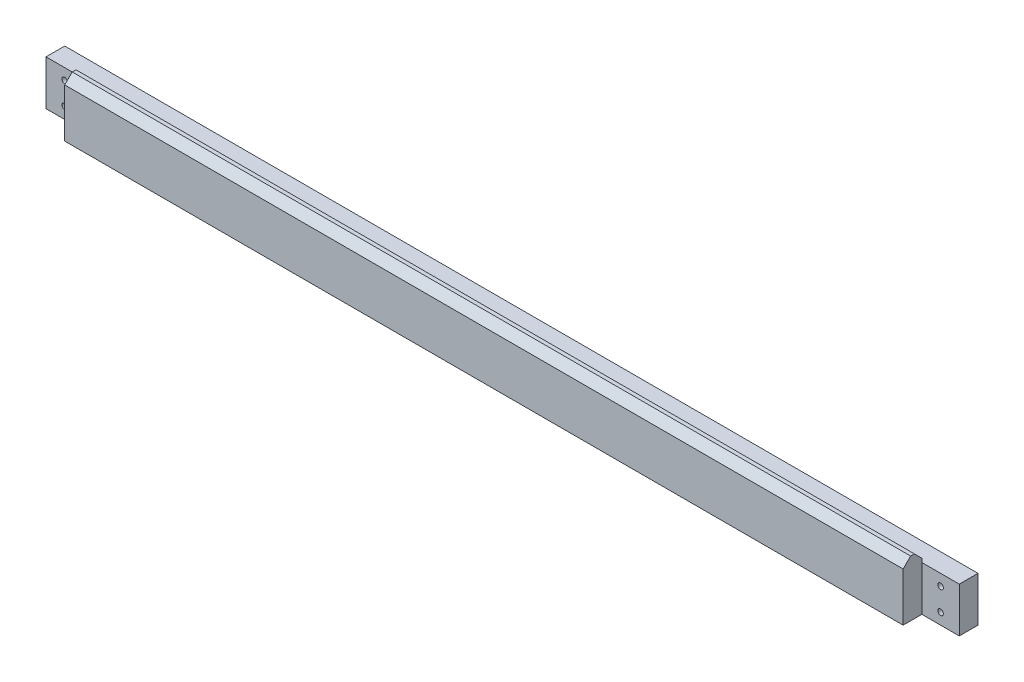
from build123d import *

# Parameters (mm, degrees)
SKETCH1_W           = 1549.4
SKETCH1_H           = 76.2
BOSS_EXTRUDE1_DEPTH = 31.75
SKETCH2_R           = 4.7625
CUT_EXTRUDE1_DEPTH  = 777.285876788
SKETCH3_W           = 1422.4
SKETCH3_H           = 95.25
BOSS_EXTRUDE2_DEPTH = 31.75
CHAMFER1_SIZE       = 12.7


with BuildPart() as part:
    # Sketch1 → Boss-Extrude1 (new body)
    with BuildSketch(Plane.XY):
        Rectangle(SKETCH1_W, SKETCH1_H)
    extrude(amount=BOSS_EXTRUDE1_DEPTH)

    # Sketch2 → Cut-Extrude1 (cut, through all)
    with BuildSketch(Plane.XY.offset(31.75)):
        with Locations((742.95, 19.05)):
            Circle(SKETCH2_R)
        with Locations((742.95, -19.05)):
            Circle(SKETCH2_R)
    cut_extrude1 = extrude(amount=-CUT_EXTRUDE1_DEPTH, mode=Mode.SUBTRACT)

    # Mirror1: Cut-Extrude1 across plane
    add(cut_extrude1.mirror(Plane(origin=(0, 0, 0), x_dir=(0, 0, 1), z_dir=(1, 0, 0))), mode=Mode.SUBTRACT)

    # Sketch3 → Boss-Extrude2 (add)
    with BuildSketch(Plane.XY.offset(31.75)):
        with Locations((0, 9.525)):
            Rectangle(SKETCH3_W, SKETCH3_H)
    extrude(amount=BOSS_EXTRUDE2_DEPTH)

    # Chamfer1
    chamfer1_edges = [part.edges().sort_by_distance(p)[0] for p in [
        (0, 57.15, 31.75),
        (0, 57.15, 63.5),
    ]]
    chamfer(chamfer1_edges, length=CHAMFER1_SIZE)


solid = part.part
